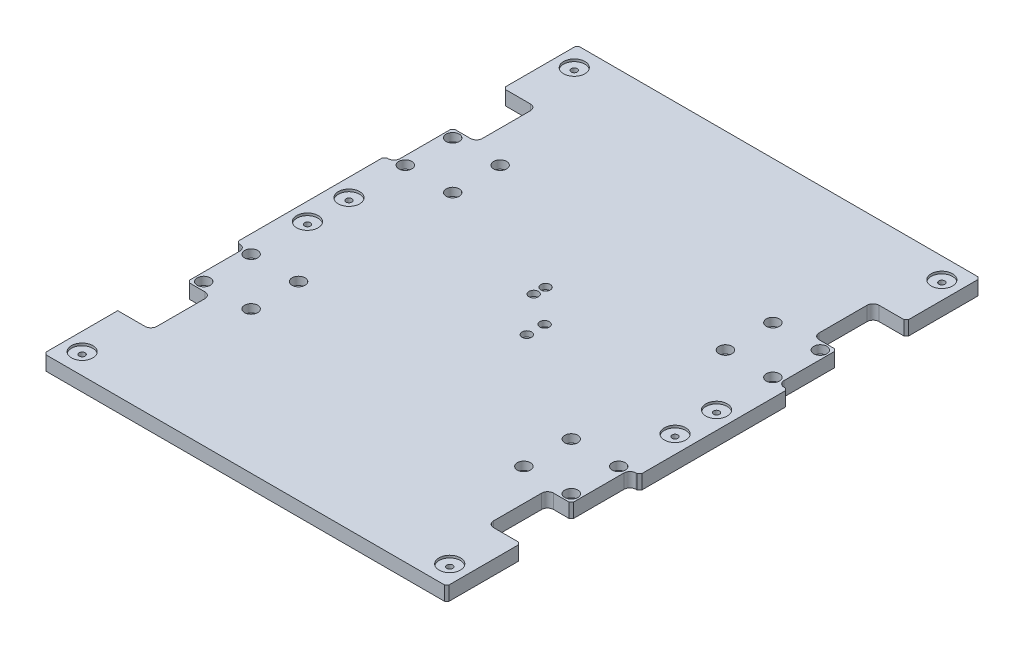
from build123d import *

# Parameters (mm, degrees)
SKETCH_1_W                  = 340
SKETCH_1_H                  = 450
EXTRUDE_1_DEPTH             = 12
HOLE_WIZARD_3_D             = 6.6
HOLE_WIZARD_3_CBORE_D       = 11
HOLE_WIZARD_3_CBORE_DEPTH   = 6.8
HOLE_WIZARD_3_2_D           = 4.5
HOLE_WIZARD_3_2_CBORE_D     = 8
HOLE_WIZARD_3_2_CBORE_DEPTH = 4.6
HOLE_WIZARD_M6_1_D          = 5
HOLE_WIZARD_1_D             = 18
HOLE_WIZARD_1_DEPTH         = 2
CUT_EXTRUDE_1_DEPTH         = 283.256975113
CHAMFER_1_SIZE              = 2


with BuildPart() as part:
    # 草图1 → 凸台-拉伸1 (new body)
    with BuildSketch(Plane(origin=(0, 0, 0), x_dir=(1, 0, 0), z_dir=(0, 1, 0))):
        Rectangle(SKETCH_1_W, SKETCH_1_H)
    extrude(amount=EXTRUDE_1_DEPTH)

    # Hole Wizard 3 (through all)
    with Locations(Plane(origin=(0, 12, 0), x_dir=(1, 0, 0), z_dir=(0, 1, 0))):
        with Locations((-115, 65), (-115, 105), (-155, 105), (-155, 65), (155, 65), (155, 105), (115, 105), (115, 65), (115, -65), (115, -105), (155, -105), (155, -65), (-155, -65), (-155, -105), (-115, -105), (-115, -65)):
            CounterBoreHole(HOLE_WIZARD_3_D / 2, HOLE_WIZARD_3_CBORE_D / 2, HOLE_WIZARD_3_CBORE_DEPTH)

    # Hole Wizard 3 2 (through all)
    with Locations(Plane(origin=(0, 12, 0), x_dir=(1, 0, 0), z_dir=(0, 1, 0))):
        with Locations((20, 7.5), (20, -7.5), (-6.7, 25), (-6.7, 35)):
            CounterBoreHole(HOLE_WIZARD_3_2_D / 2, HOLE_WIZARD_3_2_CBORE_D / 2, HOLE_WIZARD_3_2_CBORE_DEPTH)

    # M6 螺纹孔1 (through all)
    with Locations(Plane(origin=(-174.714463093, 0, 28.629345755), x_dir=(1, 0, 0), z_dir=(0, -1, 0))):
        with Locations((19.714463093, -236.129345755), (19.714463093, -46.129345755), (329.714463093, -46.129345755), (329.714463093, -236.129345755), (329.714463093, 178.870654245), (329.714463093, -11.129345755), (19.714463093, -11.129345755), (19.714463093, 178.870654245)):
            Hole(HOLE_WIZARD_M6_1_D / 2)

    # 孔1
    with Locations(Plane(origin=(0, 12, 0), x_dir=(1, 0, 0), z_dir=(0, 1, 0))):
        with Locations((-155, 17.5), (-155, 207.5), (155, 207.5), (155, 17.5), (155, -17.5), (155, -207.5), (-155, -207.5), (-155, -17.5)):
            Hole(HOLE_WIZARD_1_D / 2, depth=HOLE_WIZARD_1_DEPTH)

    # 草图13 → 切除-拉伸1 (cut, through all)
    with BuildSketch(Plane(origin=(0, 12, 0), x_dir=(1, 0, 0), z_dir=(0, 1, 0))):
        with BuildLine():
            Line((-167, 62.5), (-170, 62.5))
            Line((-170, 62.5), (-170, 162.5))
            Line((-170, 162.5), (-147, 162.5))
            ThreePointArc((-147, 162.5), (-143.464466094, 161.035533906), (-142, 157.5))
            Line((-142, 157.5), (-142, 117))
            ThreePointArc((-142, 117), (-143.464466094, 113.464466094), (-147, 112))
            Line((-147, 112), (-162, 112))
            Line((-162, 112), (-162, 67.5))
            ThreePointArc((-162, 67.5), (-163.464466094, 63.964466094), (-167, 62.5))
        make_face()
        with BuildLine():
            Line((142, 117), (142, 157.5))
            ThreePointArc((142, 157.5), (143.464466094, 161.035533906), (147, 162.5))
            Line((147, 162.5), (170, 162.5))
            Line((170, 162.5), (170, 62.5))
            Line((170, 62.5), (167, 62.5))
            ThreePointArc((167, 62.5), (163.464466094, 63.964466094), (162, 67.5))
            Line((162, 67.5), (162, 112))
            Line((162, 112), (147, 112))
            ThreePointArc((147, 112), (143.464466094, 113.464466094), (142, 117))
        make_face()
        with BuildLine():
            Line((-142, -117), (-142, -157.5))
            ThreePointArc((-142, -157.5), (-143.464466094, -161.035533906), (-147, -162.5))
            Line((-147, -162.5), (-170, -162.5))
            Line((-170, -162.5), (-170, -62.5))
            Line((-170, -62.5), (-167, -62.5))
            ThreePointArc((-167, -62.5), (-163.464466094, -63.964466094), (-162, -67.5))
            Line((-162, -67.5), (-162, -112))
            Line((-162, -112), (-147, -112))
            ThreePointArc((-147, -112), (-143.464466094, -113.464466094), (-142, -117))
        make_face()
        with BuildLine():
            Line((167, -62.5), (170, -62.5))
            Line((170, -62.5), (170, -162.5))
            Line((170, -162.5), (147, -162.5))
            ThreePointArc((147, -162.5), (143.464466094, -161.035533906), (142, -157.5))
            Line((142, -157.5), (142, -117))
            ThreePointArc((142, -117), (143.464466094, -113.464466094), (147, -112))
            Line((147, -112), (162, -112))
            Line((162, -112), (162, -67.5))
            ThreePointArc((162, -67.5), (163.464466094, -63.964466094), (167, -62.5))
        make_face()
    extrude(amount=-CUT_EXTRUDE_1_DEPTH, mode=Mode.SUBTRACT)

    # 倒角1
    chamfer_1_edges = [part.edges().sort_by_distance(p)[0] for p in [
        (-170, 6, -62.5),
        (-170, 6, -162.5),
        (-162, 6, -112),
        (170, 6, -62.5),
        (162, 6, -112),
        (170, 6, -162.5),
        (170, 6, 62.5),
        (170, 6, 162.5),
        (162, 6, 112),
        (-170, 6, 62.5),
        (-162, 6, 112),
        (170, 6, 225),
        (-170, 6, 225),
        (-170, 6, -225),
        (170, 6, -225),
    ]]
    chamfer(chamfer_1_edges, length=CHAMFER_1_SIZE)


solid = part.part
